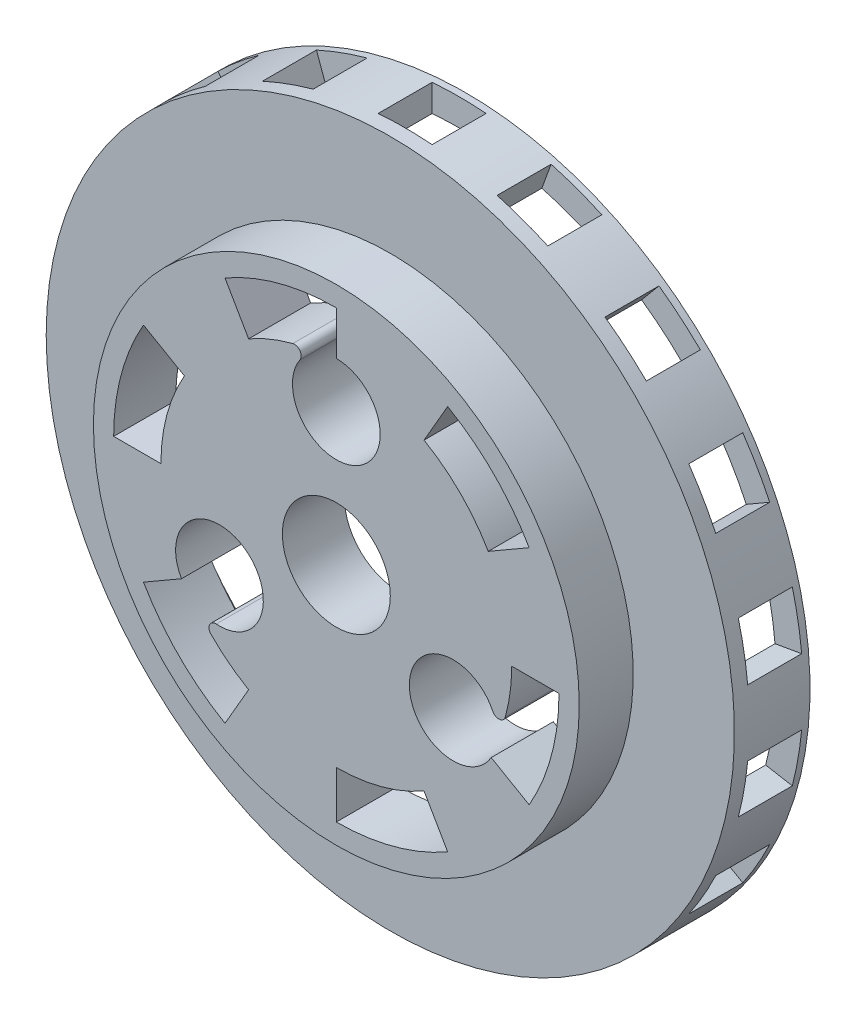
from build123d import *

# Parameters (mm, degrees)
ESQUISSE1_R                  = 18
BOSS_EXTRU_1_DEPTH           = 4
ESQUISSE5_R                  = 25.5
BOSS_EXTRU_2_DEPTH           = 0.6
ENL_V_MAT_EXTRU_1_DEPTH      = 37.354642069
ESQUISSE4_R                  = 4
ENL_V_MAT_EXTRU_3_DEPTH      = 37.354642069
R_P_TITION_CIRCULAIRE1_COUNT = 6
ESQUISSE3_R                  = 3.25
ENL_V_MAT_EXTRU_2_DEPTH      = 37.354642069
R_P_TITION_CIRCULAIRE2_COUNT = 3
CONG_1_R                     = 0.5
ESQUISSE6_R                  = 25.5
ESQUISSE6_R_2                = 23.5
BOSS_EXTRU_3_DEPTH           = 5
ESQUISSE7_W                  = 4
ESQUISSE7_H                  = 4
ENL_V_MAT_EXTRU_4_DEPTH      = 4
R_P_TITION_CIRCULAIRE3_COUNT = 18


with BuildPart() as part:
    # Esquisse1 → Boss.-Extru.1 (new body)
    with BuildSketch(Plane.XY):
        Circle(ESQUISSE1_R)
    extrude(amount=BOSS_EXTRU_1_DEPTH)

    # Esquisse5 → Boss.-Extru.2 (add)
    with BuildSketch(Plane(origin=(0, 0, 0), x_dir=(-1, 0, 0), z_dir=(0, 0, -1))):
        Circle(ESQUISSE5_R)
    extrude(amount=BOSS_EXTRU_2_DEPTH)

    # Esquisse2 → Enlèv. mat.-Extru.1 (cut, through all)
    with BuildSketch(Plane.XY.offset(4)):
        with BuildLine():
            Line((0, 13), (0, 16.5))
            ThreePointArc((0, 16.5), (-4.270514244, 15.937776134), (-8.25, 14.289419162))
            Line((-8.25, 14.289419162), (-6.5, 11.258330249))
            ThreePointArc((-6.5, 11.258330249), (-3.364647586, 12.557035742), (0, 13))
        make_face()
    enl_v_mat_extru_1 = extrude(amount=-ENL_V_MAT_EXTRU_1_DEPTH, mode=Mode.SUBTRACT)

    # Esquisse4 → Enlèv. mat.-Extru.3 (cut, through all)
    with BuildSketch(Plane.XY.offset(4)):
        Circle(ESQUISSE4_R)
    extrude(amount=-ENL_V_MAT_EXTRU_3_DEPTH, mode=Mode.SUBTRACT)

    # Répétition circulaire1: Enlèv. mat.-Extru.1 ×6 about axis
    r_p_tition_circulaire1_axis = Axis((0, 0, 4), (0, 0, 1))
    for i in range(1, R_P_TITION_CIRCULAIRE1_COUNT):
        add(enl_v_mat_extru_1.rotate(r_p_tition_circulaire1_axis, i * 360 / R_P_TITION_CIRCULAIRE1_COUNT), mode=Mode.SUBTRACT)

    # Esquisse3 → Enlèv. mat.-Extru.2 (cut, through all)
    with BuildSketch(Plane.XY.offset(4)):
        with Locations((0, 10)):
            Circle(ESQUISSE3_R)
    enl_v_mat_extru_2 = extrude(amount=-ENL_V_MAT_EXTRU_2_DEPTH, mode=Mode.SUBTRACT)

    # Répétition circulaire2: Enlèv. mat.-Extru.2 ×3 about axis
    r_p_tition_circulaire2_axis = Axis((0, 0, 4), (0, 0, 1))
    for i in range(1, R_P_TITION_CIRCULAIRE2_COUNT):
        add(enl_v_mat_extru_2.rotate(r_p_tition_circulaire2_axis, i * 360 / R_P_TITION_CIRCULAIRE2_COUNT), mode=Mode.SUBTRACT)

    # Congé1
    cong_1_edges = [part.edges().sort_by_distance(p)[0] for p in [
        (11.902210222, -5.228517173, 1.7),
        (-10.479133807, -7.693357827, 1.7),
        (-1.423076416, 12.921875, 1.7),
    ]]
    fillet(cong_1_edges, radius=CONG_1_R)

    # Esquisse6 → Boss.-Extru.3 (add)
    with BuildSketch(Plane(origin=(0, 0, -0.6), x_dir=(-1, 0, 0), z_dir=(0, 0, -1))):
        Circle(ESQUISSE6_R)
        Circle(ESQUISSE6_R_2, mode=Mode.SUBTRACT)
    extrude(amount=BOSS_EXTRU_3_DEPTH)

    # Esquisse7 → Enlèv. mat.-Extru.4 (cut)
    with BuildSketch(Plane(origin=(0, 25.5, 0), x_dir=(1, 0, 0), z_dir=(0, 1, 0))):
        with Locations((0, 3.1)):
            Rectangle(ESQUISSE7_W, ESQUISSE7_H)
    enl_v_mat_extru_4 = extrude(amount=-ENL_V_MAT_EXTRU_4_DEPTH, mode=Mode.SUBTRACT)

    # Répétition circulaire3: Enlèv. mat.-Extru.4 ×18 about axis
    r_p_tition_circulaire3_axis = Axis((0, 0, -0.6), (0, 0, 1))
    for i in range(1, R_P_TITION_CIRCULAIRE3_COUNT):
        add(enl_v_mat_extru_4.rotate(r_p_tition_circulaire3_axis, i * 360 / R_P_TITION_CIRCULAIRE3_COUNT), mode=Mode.SUBTRACT)


solid = part.part
